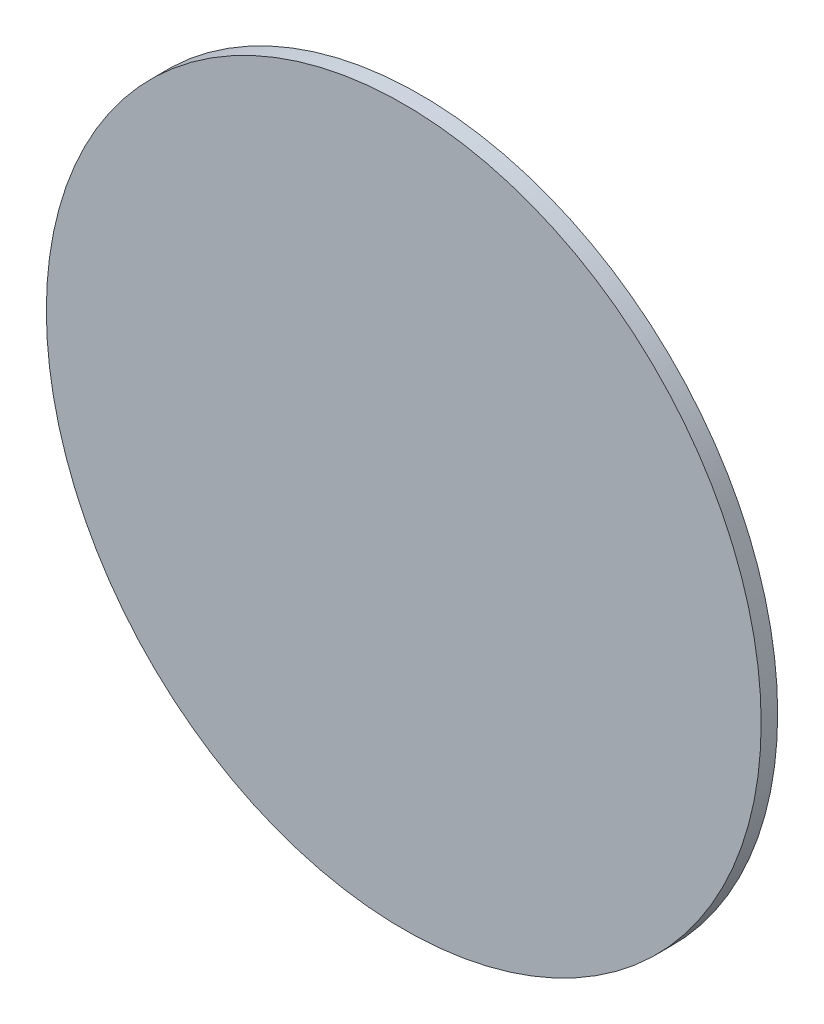
from build123d import *

# Parameters (mm, degrees)
SKETCH1_R           = 65
BOSS_EXTRUDE1_DEPTH = 3


with BuildPart() as part:
    # Sketch1 → Boss-Extrude1 (new body)
    with BuildSketch(Plane.XY):
        Circle(SKETCH1_R)
    extrude(amount=BOSS_EXTRUDE1_DEPTH)


solid = part.part
